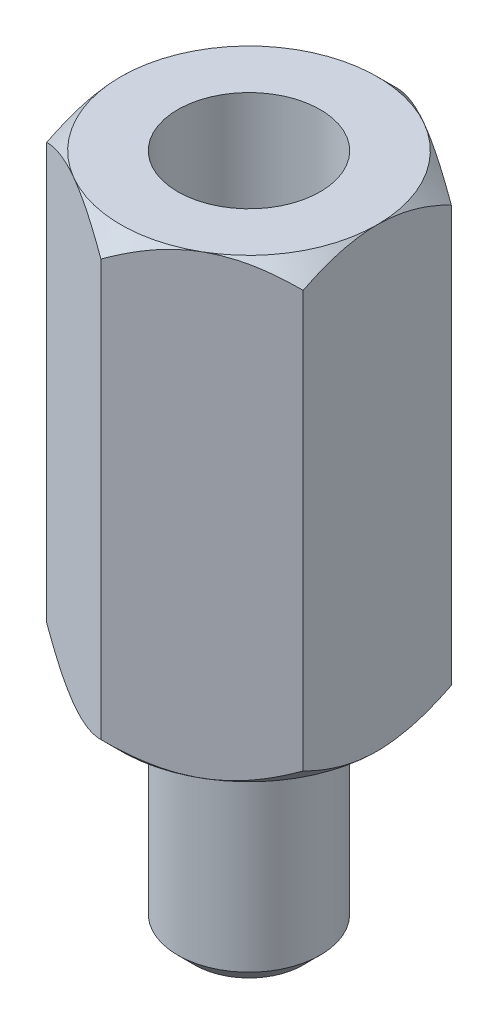
from build123d import *

# Parameters (mm, degrees)
SKETCH1_R           = 1.25
BOSS_EXTRUDE1_DEPTH = 3.9
BOSS_EXTRUDE2_DEPTH = 8
CUT_EXTRUDE1_START  = -4.8
SKETCH3_R           = 1.25
CUT_EXTRUDE1_DEPTH  = 4.8
SKETCH4_OUTSIDE_W   = 36.022
SKETCH4_OUTSIDE_H   = 36.718
SKETCH4_OUTSIDE_R   = 2.25
CUT_EXTRUDE2_DEPTH  = 13.386383653
CUT_EXTRUDE2_DRAFT  = -45
SKETCH5_OUTSIDE_W   = 28.662
SKETCH5_OUTSIDE_H   = 29.358
SKETCH5_OUTSIDE_R   = 2.248577877
CUT_EXTRUDE3_DEPTH  = 9.707037384
CUT_EXTRUDE3_DRAFT  = -45
CHAMFER1_SIZE       = 0.3


with BuildPart() as part:
    # Sketch1 → Boss-Extrude1 (new body)
    with BuildSketch(Plane(origin=(0, 0, 0), x_dir=(1, 0, 0), z_dir=(0, 1, 0))):
        with Locations(Location((0, 0, 0), (0, 0, 270))):
            Circle(SKETCH1_R)
    extrude(amount=BOSS_EXTRUDE1_DEPTH)

    # Sketch2 → Boss-Extrude2 (add)
    with BuildSketch(Plane(origin=(0, 3.9, 0), x_dir=(1, 0, 0), z_dir=(0, 1, 0))):
        Polygon((0, 2.598076211), (-2.25, 1.299038106), (-2.25, -1.299038106), (0, -2.598076211), (2.25, -1.299038106), (2.25, 1.299038106), align=None)
    extrude(amount=BOSS_EXTRUDE2_DEPTH)

    # Sketch3 → Cut-Extrude1 (cut)
    with BuildSketch(Plane(origin=(0, 11.9, 0), x_dir=(1, 0, 0), z_dir=(0, 1, 0)).offset(CUT_EXTRUDE1_START)):
        with Locations(Location((0, 0, 0), (0, 0, 270))):
            Circle(SKETCH3_R)
    extrude(amount=CUT_EXTRUDE1_DEPTH, mode=Mode.SUBTRACT)


with BuildPart() as cut_extrude2_tool:
    # Sketch4 outside → Cut-Extrude2 (with draft: the straight prism first)
    with BuildSketch(Plane(origin=(0, 11.9, 0), x_dir=(1, 0, 0), z_dir=(0, 1, 0))):
        Rectangle(SKETCH4_OUTSIDE_W, SKETCH4_OUTSIDE_H)
        Circle(SKETCH4_OUTSIDE_R, mode=Mode.SUBTRACT)
    extrude(amount=-CUT_EXTRUDE2_DEPTH)
    # Cut-Extrude2: the draft: its side faces are tilted about the plane it starts from
    cut_extrude2_sides = [cut_extrude2_tool.faces().sort_by_distance(p)[0] for p in [
        (0, 5.206808173, 18.359),
        (18.011, 5.206808173, 0),
        (0, 5.206808173, -18.359),
        (-18.011, 5.206808173, 0),
        (-2.25, 5.206808173, 0),
    ]]
    draft(cut_extrude2_sides, Plane(origin=(0, 11.9, 0), x_dir=(1, 0, 0), z_dir=(0, 1, 0)), CUT_EXTRUDE2_DRAFT)


with BuildPart() as part_1:
    add(part.part)

    # Cut-Extrude2: cut by cut_extrude2_tool
    add(cut_extrude2_tool.part, mode=Mode.SUBTRACT)


with BuildPart() as cut_extrude3_tool:
    # Sketch5 outside → Cut-Extrude3 (with draft: the straight prism first)
    with BuildSketch(Plane.XZ.offset(-3.9)):
        Rectangle(SKETCH5_OUTSIDE_W, SKETCH5_OUTSIDE_H)
        Circle(SKETCH5_OUTSIDE_R, mode=Mode.SUBTRACT)
    extrude(amount=-CUT_EXTRUDE3_DEPTH)
    # Cut-Extrude3: the draft: its side faces are tilted about the plane it starts from
    cut_extrude3_sides = [cut_extrude3_tool.faces().sort_by_distance(p)[0] for p in [
        (0, 8.753518692, -14.679),
        (14.331, 8.753518692, 0),
        (0, 8.753518692, 14.679),
        (-14.331, 8.753518692, 0),
        (-2.248577877, 8.753518692, 0),
    ]]
    draft(cut_extrude3_sides, Plane.XZ.offset(-3.9), CUT_EXTRUDE3_DRAFT)


with BuildPart() as part_2:
    add(part_1.part)

    # Cut-Extrude3: cut by cut_extrude3_tool
    add(cut_extrude3_tool.part, mode=Mode.SUBTRACT)

    # Chamfer1
    chamfer1_edges = [part_2.edges().sort_by_distance(p)[0] for p in [
        (0, 0, -1.25),
    ]]
    chamfer(chamfer1_edges, length=CHAMFER1_SIZE)


solid = part_2.part
